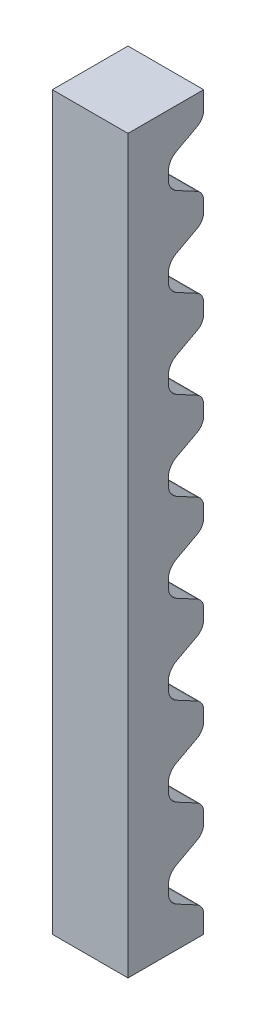
from build123d import *

# Parameters (mm, degrees)
RACK_DEPTH = 30


with BuildPart() as part:
    # Sketch1 → RACK (new body)
    with BuildSketch(Plane(origin=(0, 0, 0), x_dir=(0, 0, -1), z_dir=(1, 0, 0))):
        with BuildLine():
            Line((0, 0), (0, -290))
            Line((0, -290), (30, -290))
            Line((30, -290), (30, -282.993707205))
            ThreePointArc((30, -282.993707205), (29.289844712, -280.4251994), (27.361107063, -278.586307355))
            Line((27.361107063, -278.586307355), (19.166671525, -274.196431174))
            ThreePointArc((19.166671525, -274.196431174), (16.852186345, -271.98976072), (16, -268.907551354))
            Line((16, -268.907551354), (16, -266.092448646))
            ThreePointArc((16, -266.092448646), (16.852186345, -263.01023928), (19.166671525, -260.803568826))
            Line((19.166671525, -260.803568826), (27.361107063, -256.413692645))
            ThreePointArc((27.361107063, -256.413692645), (29.289844712, -254.5748006), (30, -252.006292795))
            Line((30, -252.006292795), (30, -247.993707205))
            ThreePointArc((30, -247.993707205), (29.289844712, -245.4251994), (27.361107063, -243.586307355))
            Line((27.361107063, -243.586307355), (19.166671525, -239.196431174))
            ThreePointArc((19.166671525, -239.196431174), (16.852186345, -236.98976072), (16, -233.907551354))
            Line((16, -233.907551354), (16, -231.092448646))
            ThreePointArc((16, -231.092448646), (16.852186345, -228.01023928), (19.166671525, -225.803568826))
            Line((19.166671525, -225.803568826), (27.361107063, -221.413692645))
            ThreePointArc((27.361107063, -221.413692645), (29.289844712, -219.5748006), (30, -217.006292795))
            Line((30, -217.006292795), (30, -212.993707205))
            ThreePointArc((30, -212.993707205), (29.289844712, -210.4251994), (27.361107063, -208.586307355))
            Line((27.361107063, -208.586307355), (19.166671525, -204.196431174))
            ThreePointArc((19.166671525, -204.196431174), (16.852186345, -201.98976072), (16, -198.907551354))
            Line((16, -198.907551354), (16, -196.092448646))
            ThreePointArc((16, -196.092448646), (16.852186345, -193.01023928), (19.166671525, -190.803568826))
            Line((19.166671525, -190.803568826), (27.361107063, -186.413692645))
            ThreePointArc((27.361107063, -186.413692645), (29.289844712, -184.5748006), (30, -182.006292795))
            Line((30, -182.006292795), (30, -177.993707205))
            ThreePointArc((30, -177.993707205), (29.289844712, -175.4251994), (27.361107063, -173.586307355))
            Line((27.361107063, -173.586307355), (19.166671525, -169.196431174))
            ThreePointArc((19.166671525, -169.196431174), (16.852186345, -166.98976072), (16, -163.907551354))
            Line((16, -163.907551354), (16, -161.092448646))
            ThreePointArc((16, -161.092448646), (16.852186345, -158.01023928), (19.166671525, -155.803568826))
            Line((19.166671525, -155.803568826), (27.361107063, -151.413692645))
            ThreePointArc((27.361107063, -151.413692645), (29.289844712, -149.5748006), (30, -147.006292795))
            Line((30, -147.006292795), (30, -142.993707205))
            ThreePointArc((30, -142.993707205), (29.289844712, -140.4251994), (27.361107063, -138.586307355))
            Line((27.361107063, -138.586307355), (19.166671525, -134.196431174))
            ThreePointArc((19.166671525, -134.196431174), (16.852186345, -131.98976072), (16, -128.907551354))
            Line((16, -128.907551354), (16, -126.092448646))
            ThreePointArc((16, -126.092448646), (16.852186345, -123.01023928), (19.166671525, -120.803568826))
            Line((19.166671525, -120.803568826), (27.361107063, -116.413692645))
            ThreePointArc((27.361107063, -116.413692645), (29.289844712, -114.5748006), (30, -112.006292795))
            Line((30, -112.006292795), (30, -107.993707205))
            ThreePointArc((30, -107.993707205), (29.289844712, -105.4251994), (27.361107063, -103.586307355))
            Line((27.361107063, -103.586307355), (19.166671525, -99.196431174))
            ThreePointArc((19.166671525, -99.196431174), (16.852186345, -96.98976072), (16, -93.907551354))
            Line((16, -93.907551354), (16, -91.092448646))
            ThreePointArc((16, -91.092448646), (16.852186345, -88.01023928), (19.166671525, -85.803568826))
            Line((19.166671525, -85.803568826), (27.361107063, -81.413692645))
            ThreePointArc((27.361107063, -81.413692645), (29.289844712, -79.5748006), (30, -77.006292795))
            Line((30, -77.006292795), (30, -72.993707205))
            ThreePointArc((30, -72.993707205), (29.289844712, -70.4251994), (27.361107063, -68.586307355))
            Line((27.361107063, -68.586307355), (19.166671525, -64.196431174))
            ThreePointArc((19.166671525, -64.196431174), (16.852186345, -61.98976072), (16, -58.907551354))
            Line((16, -58.907551354), (16, -56.092448646))
            ThreePointArc((16, -56.092448646), (16.852186345, -53.01023928), (19.166671525, -50.803568826))
            Line((19.166671525, -50.803568826), (27.361107063, -46.413692645))
            ThreePointArc((27.361107063, -46.413692645), (29.289844712, -44.5748006), (30, -42.006292795))
            Line((30, -42.006292795), (30, -37.993707205))
            ThreePointArc((30, -37.993707205), (29.289844712, -35.4251994), (27.361107063, -33.586307355))
            Line((27.361107063, -33.586307355), (19.166671525, -29.196431174))
            ThreePointArc((19.166671525, -29.196431174), (16.852186345, -26.98976072), (16, -23.907551354))
            Line((16, -23.907551354), (16, -21.092448646))
            ThreePointArc((16, -21.092448646), (16.852186345, -18.01023928), (19.166671525, -15.803568826))
            Line((19.166671525, -15.803568826), (27.361107063, -11.413692645))
            ThreePointArc((27.361107063, -11.413692645), (29.289844712, -9.5748006), (30, -7.006292795))
            Line((30, -7.006292795), (30, 0))
            Line((30, 0), (0, 0))
        make_face()
    extrude(amount=RACK_DEPTH)


solid = part.part
